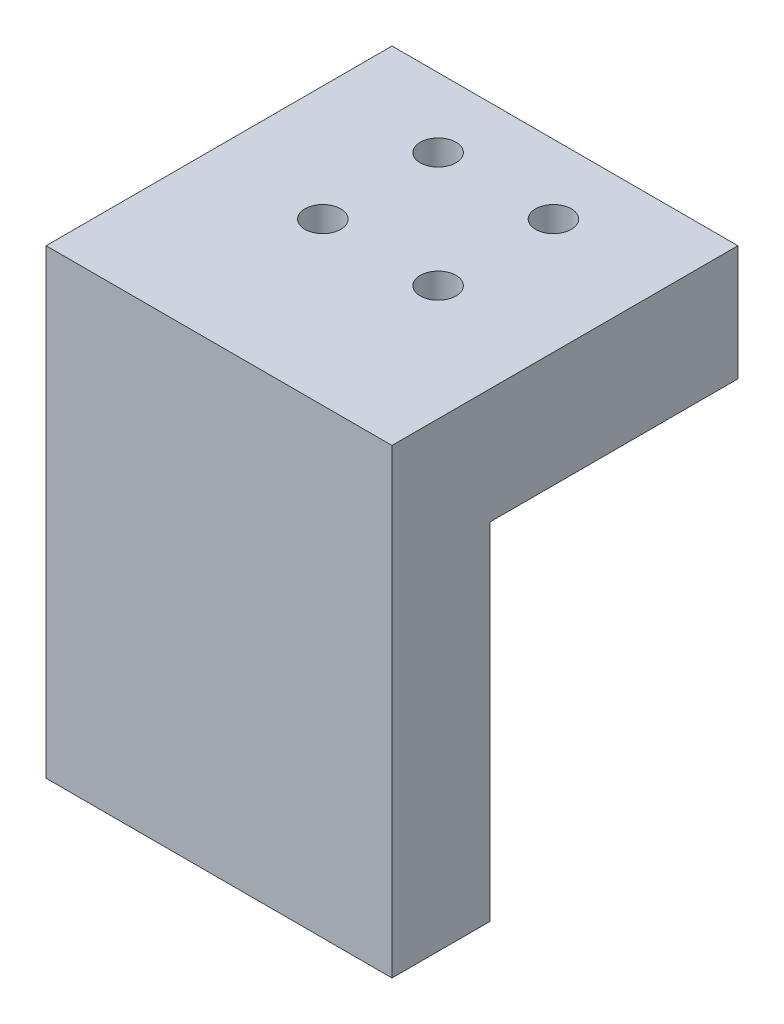
from build123d import *

# Parameters (mm, degrees)
SKETCH_1_W          = 30
SKETCH_1_H          = 30
EXTRUDE_1_DEPTH     = 10
SKETCH_3_W          = 30
SKETCH_3_H          = 7
SKETCH_3_H_2        = 1.5
EXTRUDE_3_DEPTH     = 30
SKETCH_4_R          = 1.55
CUT_EXTRUDE_1_DEPTH = 30
SKETCH_5_R          = 3.5
SKETCH_5_R_2        = 1.55
CUT_EXTRUDE_2_DEPTH = 3


with BuildPart() as part:
    # 草图1 → 凸台-拉伸1 (new body)
    with BuildSketch(Plane(origin=(0, 0, 0), x_dir=(1, 0, 0), z_dir=(0, 1, 0))):
        Rectangle(SKETCH_1_W, SKETCH_1_H)
    extrude(amount=EXTRUDE_1_DEPTH)

    # 草图3 → 凸台-拉伸3 (add)
    with BuildSketch(Plane.XZ):
        with Locations((0, 10)):
            Rectangle(SKETCH_3_W, SKETCH_3_H)
        with Locations((0, 14.25)):
            Rectangle(SKETCH_3_W, SKETCH_3_H_2)
    extrude(amount=EXTRUDE_3_DEPTH)

    # 草图4 → 切除-拉伸1 (cut)
    with BuildSketch(Plane.XZ):
        with Locations(Location((5, 1, 0), (0, 0, 270))):
            Circle(SKETCH_4_R)
        with Locations(Location((5, -9, 0), (0, 0, 270))):
            Circle(SKETCH_4_R)
        with Locations(Location((-5, 1, 0), (0, 0, 270))):
            Circle(SKETCH_4_R)
        with Locations(Location((-5, -9, 0), (0, 0, 270))):
            Circle(SKETCH_4_R)
    extrude(amount=-CUT_EXTRUDE_1_DEPTH, mode=Mode.SUBTRACT)

    # 草图5 → 切除-拉伸2 (cut)
    # profile 1 of 4: a face of its own
    with BuildSketch(Plane.XZ):
        with Locations(Location((5, 1, 0), (0, 0, 270))):
            Circle(SKETCH_5_R)
        with Locations(Location((5, 1, 0), (0, 0, 270))):
            Circle(SKETCH_5_R_2, mode=Mode.SUBTRACT)
    # profile 2 of 4: a face of its own
    with BuildSketch(Plane.XZ):
        with Locations(Location((5, -9, 0), (0, 0, 270))):
            Circle(SKETCH_5_R)
        with Locations(Location((5, -9, 0), (0, 0, 270))):
            Circle(SKETCH_5_R_2, mode=Mode.SUBTRACT)
    # profile 3 of 4: a face of its own
    with BuildSketch(Plane.XZ):
        with Locations(Location((-5, -9, 0), (0, 0, 270))):
            Circle(SKETCH_5_R)
        with Locations(Location((-5, -9, 0), (0, 0, 270))):
            Circle(SKETCH_5_R_2, mode=Mode.SUBTRACT)
    # profile 4 of 4: a face of its own
    with BuildSketch(Plane.XZ):
        with Locations(Location((-5, 1, 0), (0, 0, 270))):
            Circle(SKETCH_5_R)
    extrude(amount=-CUT_EXTRUDE_2_DEPTH, mode=Mode.SUBTRACT)


solid = part.part
